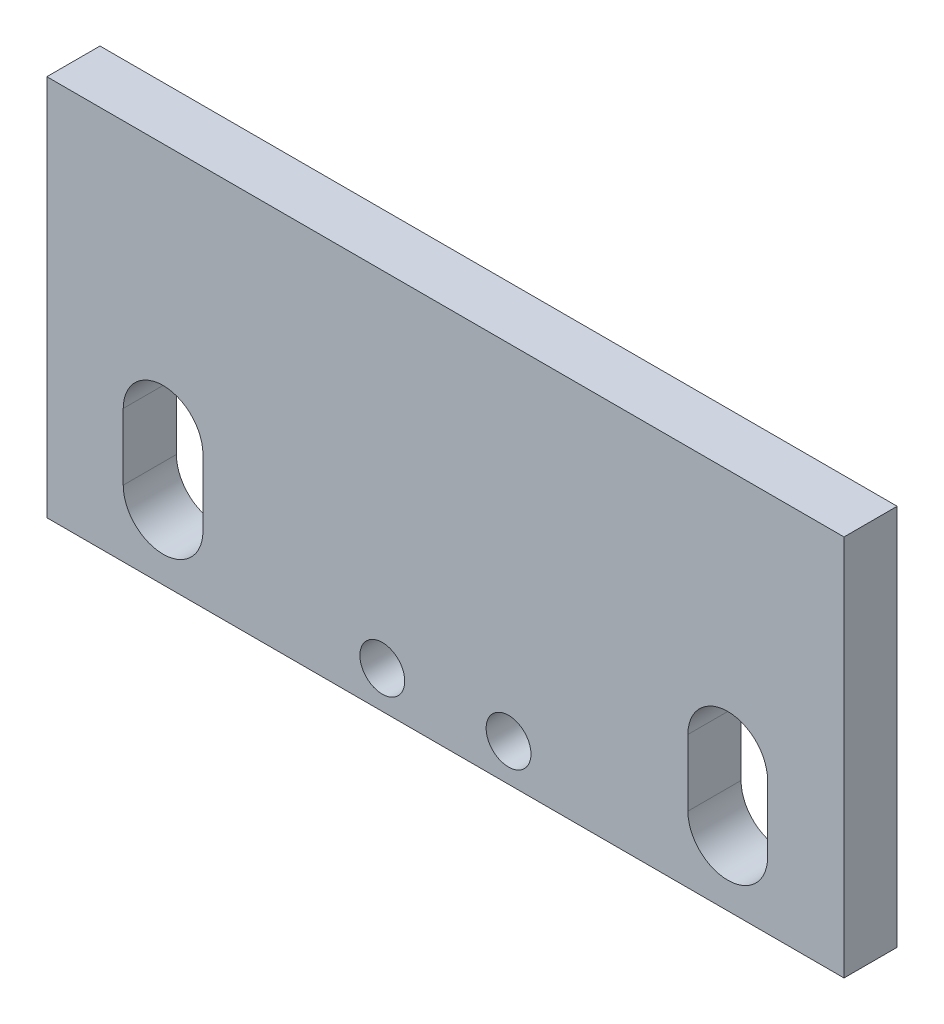
from build123d import *

# Parameters (mm, degrees)
SKETCH2_W           = 23.999949
SKETCH2_H           = 11.5
SKETCH2_R           = 0.675
BOSS_EXTRUDE1_DEPTH = 1.6


with BuildPart() as part:
    # Sketch2 → Boss-Extrude1 (new body)
    with BuildSketch(Plane.XY):
        with Locations((3.994128142, 5.784892068)):
            Rectangle(SKETCH2_W, SKETCH2_H)
        with Locations((2.094154642, 1.159893068)):
            Circle(SKETCH2_R, mode=Mode.SUBTRACT)
        with Locations((5.894154642, 1.159893068)):
            Circle(SKETCH2_R, mode=Mode.SUBTRACT)
        with BuildLine():
            Line((11.294102642, 2.034892068), (11.294102642, 4.034892068))
            ThreePointArc((11.294102642, 4.034892068), (12.494102642, 5.234892068), (13.694102642, 4.034892068))
            Line((13.694102642, 4.034892068), (13.694102642, 2.034892068))
            ThreePointArc((13.694102642, 2.034892068), (12.494102642, 0.834892068), (11.294102642, 2.034892068))
        make_face(mode=Mode.SUBTRACT)
        with BuildLine():
            Line((-3.305846358, 2.034892068), (-3.305846358, 4.034892068))
            ThreePointArc((-3.305846358, 4.034892068), (-4.505846358, 5.234892068), (-5.705846358, 4.034892068))
            Line((-5.705846358, 4.034892068), (-5.705846358, 2.034892068))
            ThreePointArc((-5.705846358, 2.034892068), (-4.505846358, 0.834892068), (-3.305846358, 2.034892068))
        make_face(mode=Mode.SUBTRACT)
    extrude(amount=BOSS_EXTRUDE1_DEPTH)


solid = part.part
